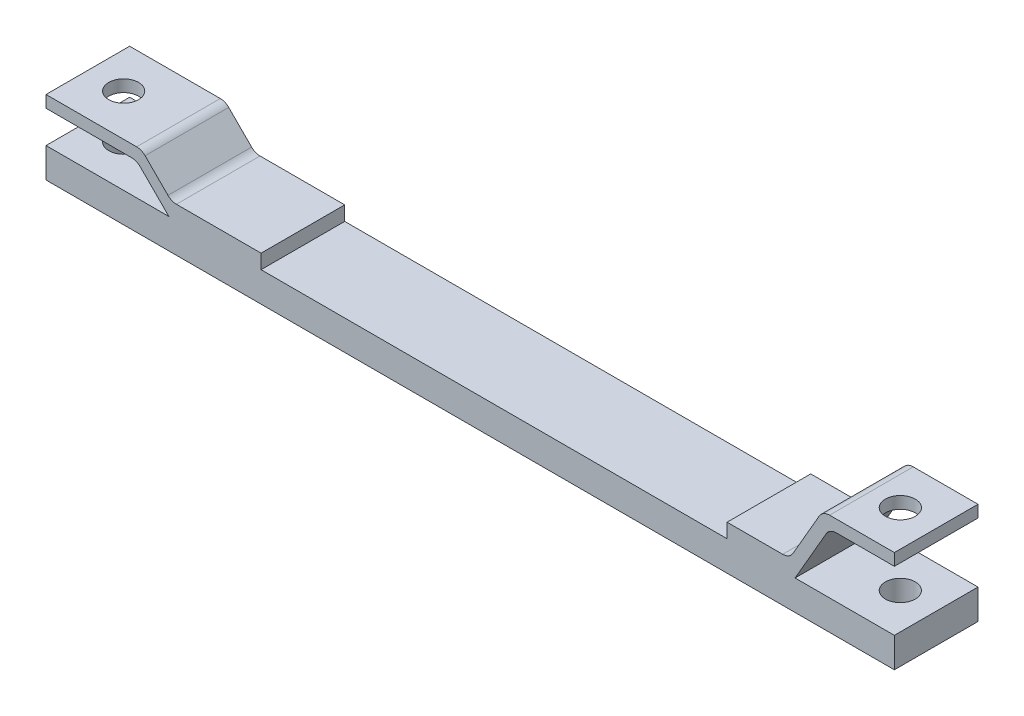
from build123d import *

# Parameters (mm, degrees)
BOSS_EXTRUDE1_DEPTH = 70
FILLET1_R           = 10
SKETCH2_R           = 12.5
CUT_EXTRUDE1_DEPTH  = 719.487995724


with BuildPart() as part:
    # Sketch1 → Boss-Extrude1 (new body)
    with BuildSketch(Plane.XY):
        Polygon((0, 62), (0, 52), (75.857864376, 52), (102.857864376, 25), (0, 25), (0, 0), (710, 0), (710, 25), (626.905989232, 25), (655.773502692, 75), (710, 75), (710, 85), (650, 85), (622.287187079, 37), (570, 37), (570, 25), (180, 25), (180, 37), (105, 37), (80, 62), align=None)
    extrude(amount=BOSS_EXTRUDE1_DEPTH)

    # Fillet1
    fillet1_edges = [part.edges().sort_by_distance(p)[0] for p in [
        (622.287187079, 37, 35),
        (650, 85, 35),
        (655.773502692, 75, 35),
        (105, 37, 35),
        (80, 62, 35),
        (75.857864376, 52, 35),
    ]]
    fillet(fillet1_edges, radius=FILLET1_R)

    # Sketch2 → Cut-Extrude1 (cut, through all)
    with BuildSketch(Plane(origin=(0, 85, 0), x_dir=(1, 0, 0), z_dir=(0, 1, 0))):
        with Locations(Location((680, -35, 0), (0, 0, 180))):
            Circle(SKETCH2_R)
        with Locations(Location((30, -35, 0), (0, 0, 180))):
            Circle(SKETCH2_R)
    extrude(amount=-CUT_EXTRUDE1_DEPTH, mode=Mode.SUBTRACT)


solid = part.part
